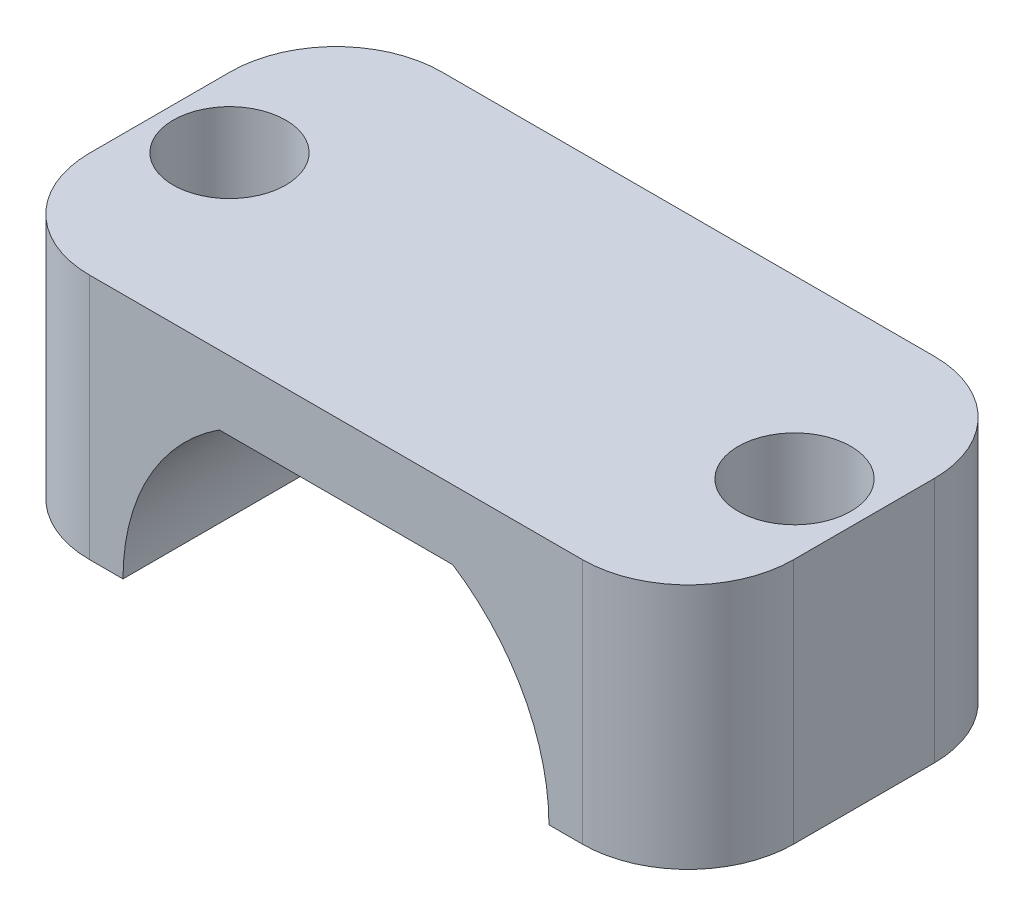
from build123d import *

# Parameters (mm, degrees)
BOSS_EXTRUDE1_DEPTH = 5
SKETCH2_R           = 1.6
CUT_EXTRUDE1_DEPTH  = 14.190905958
FILLET3_R           = 3


with BuildPart() as part:
    # Sketch1 → Boss-Extrude1 (new, symmetric)
    with BuildSketch(Plane.XY):
        with BuildLine():
            Line((-10, 0), (10, 0))
            Line((10, 0), (10, -7))
            Line((10, -7), (6.05, -7))
            ThreePointArc((6.05, -7), (5.322096357, -4.135562883), (3.315, -1.966137169))
            Line((3.315, -1.966137169), (-3.315, -1.966137169))
            ThreePointArc((-3.315, -1.966137169), (-5.322096357, -4.135562883), (-6.05, -7))
            Line((-6.05, -7), (-10, -7))
            Line((-10, -7), (-10, 0))
        make_face()
    extrude(amount=BOSS_EXTRUDE1_DEPTH, both=True)

    # Sketch2 → Cut-Extrude1 (cut, through all)
    with BuildSketch(Plane.XZ.offset(7)):
        with Locations(Location((8.025, 0, 0), (0, 0, 270))):
            Circle(SKETCH2_R)
        with Locations(Location((-8.025, 0, 0), (0, 0, 270))):
            Circle(SKETCH2_R)
    extrude(amount=-CUT_EXTRUDE1_DEPTH, mode=Mode.SUBTRACT)

    # Fillet3
    fillet3_edges = [part.edges().sort_by_distance(p)[0] for p in [
        (-10, -3.5, -5),
        (10, -3.5, -5),
        (-10, -3.5, 5),
        (10, -3.5, 5),
    ]]
    fillet(fillet3_edges, radius=FILLET3_R)


solid = part.part
